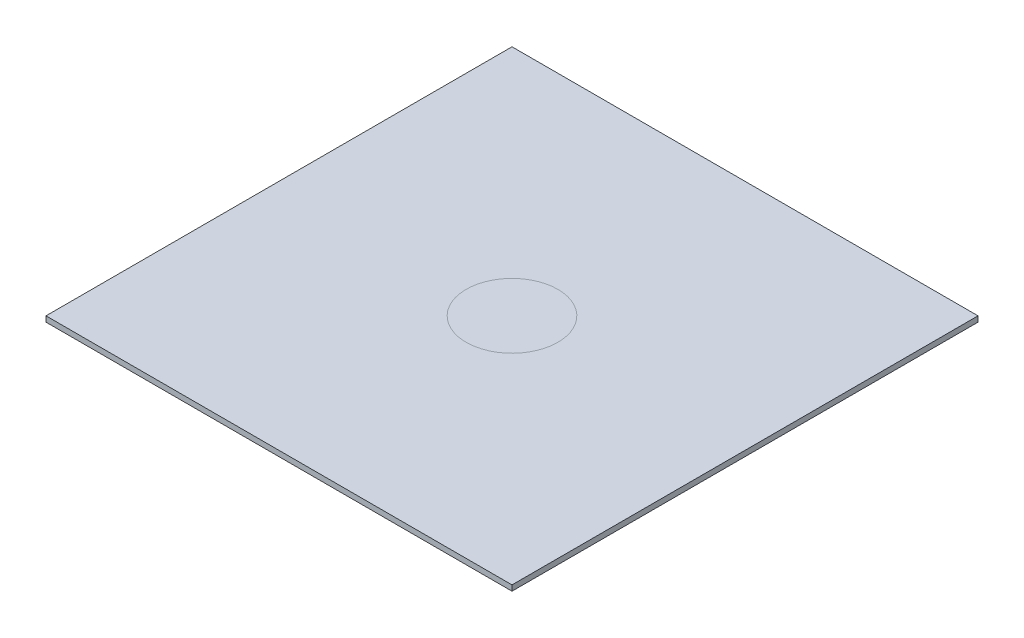
from build123d import *

# Parameters (mm, degrees)
SKETCH1_W           = 254
SKETCH1_H           = 254
BOSS_EXTRUDE1_DEPTH = 1.5


with BuildPart() as part:
    # Sketch1 → Boss-Extrude1 (new, symmetric)
    with BuildSketch(Plane(origin=(0, 0, 0), x_dir=(1, 0, 0), z_dir=(0, 1, 0))):
        Rectangle(SKETCH1_W, SKETCH1_H)
    extrude(amount=BOSS_EXTRUDE1_DEPTH, both=True)


solid = part.part
